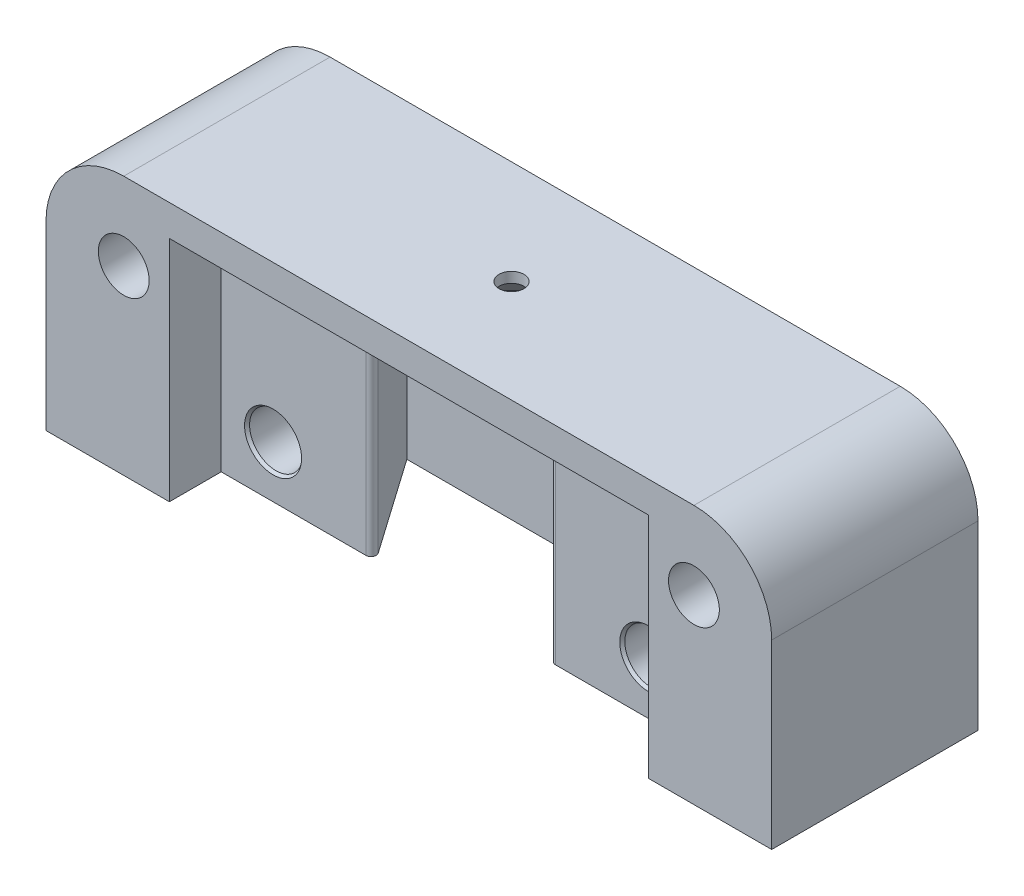
from build123d import *

# Parameters (mm, degrees)
BOSS_EXTRUDE1_DEPTH                             = 25
SKETCH2_R                                       = 2.45
CUT_EXTRUDE1_DEPTH                              = 25
FILLET1_R                                       = 7.5
SKETCH3_W                                       = 55
SKETCH3_H                                       = 19.9
BOSS_EXTRUDE2_DEPTH                             = 3
CSK_FOR_M2_FLAT_HEAD_MACHINE_SCREW1_D           = 2.4
CSK_FOR_M2_FLAT_HEAD_MACHINE_SCREW1_DEPTH       = 10
CSK_FOR_M2_FLAT_HEAD_MACHINE_SCREW1_CSINK_D     = 6.4
CSK_FOR_M2_FLAT_HEAD_MACHINE_SCREW1_CSINK_ANGLE = 90
CSK_FOR_M2_FLAT_HEAD_MACHINE_SCREW1_TIP         = 0.721032743
FILLET2_R                                       = 0.5
CSK_FOR_M5_FLAT_HEAD_MACHINE_SCREW1_D           = 5.1
CSK_FOR_M5_FLAT_HEAD_MACHINE_SCREW1_DEPTH       = 6
CSK_FOR_M5_FLAT_HEAD_MACHINE_SCREW1_CSINK_D     = 5.5
CSK_FOR_M5_FLAT_HEAD_MACHINE_SCREW1_CSINK_ANGLE = 70


with BuildPart() as part:
    # Sketch1 → Boss-Extrude1 (new body)
    with BuildSketch(Plane(origin=(0, 0, 0), x_dir=(1, 0, 0), z_dir=(0, 1, 0))):
        Polygon((-35, 10), (-35, -9.9), (-23.097924618, -9.9), (-23.097924618, -5), (-23.097924618, -4.9), (-22.997924618, -4.9), (-8.190022831, -4.9), (-15.192098213, 5.1), (15.192098213, 5.1), (8.190022831, -4.9), (22.997924618, -4.9), (23.097924618, -4.9), (23.097924618, -5), (23.097924618, -9.9), (35, -9.9), (35, 10), align=None)
    extrude(amount=BOSS_EXTRUDE1_DEPTH)

    # Sketch2 → Cut-Extrude1 (cut)
    with BuildSketch(Plane(origin=(0, 0, -10), x_dir=(-1, 0, 0), z_dir=(0, 0, -1))):
        with Locations((-27.5, 17.5)):
            Circle(SKETCH2_R)
        with Locations((27.5, 17.5)):
            Circle(SKETCH2_R)
    extrude(amount=-CUT_EXTRUDE1_DEPTH, mode=Mode.SUBTRACT)

    # Fillet1
    fillet1_edges = [part.edges().sort_by_distance(p)[0] for p in [
        (-35, 25, -0.05),
        (35, 25, -0.05),
    ]]
    fillet(fillet1_edges, radius=FILLET1_R)

    # Sketch3 → Boss-Extrude2 (add)
    with BuildSketch(Plane(origin=(0, 25, 0), x_dir=(1, 0, 0), z_dir=(0, 1, 0))):
        with Locations((0, 0.05)):
            Rectangle(SKETCH3_W, SKETCH3_H)
    extrude(amount=-BOSS_EXTRUDE2_DEPTH)

    # CSK for M2 Flat Head Machine Screw1
    with Locations(Plane(origin=(0, 22, 0), x_dir=(-1, 0, 0), z_dir=(0, -1, 0))):
        with Locations((0, 0)):
            CounterSinkHole(CSK_FOR_M2_FLAT_HEAD_MACHINE_SCREW1_D / 2, CSK_FOR_M2_FLAT_HEAD_MACHINE_SCREW1_CSINK_D / 2, depth=CSK_FOR_M2_FLAT_HEAD_MACHINE_SCREW1_DEPTH, counter_sink_angle=CSK_FOR_M2_FLAT_HEAD_MACHINE_SCREW1_CSINK_ANGLE)
            with Locations((0, 0, -(CSK_FOR_M2_FLAT_HEAD_MACHINE_SCREW1_DEPTH + CSK_FOR_M2_FLAT_HEAD_MACHINE_SCREW1_TIP / 2))):  # 118° drill point
                Cone(0, CSK_FOR_M2_FLAT_HEAD_MACHINE_SCREW1_D / 2, CSK_FOR_M2_FLAT_HEAD_MACHINE_SCREW1_TIP, mode=Mode.SUBTRACT)

    # Fillet2
    fillet2_edges = [part.edges().sort_by_distance(p)[0] for p in [
        (8.190022831, 11, 4.9),
        (-8.190022831, 11, 4.9),
    ]]
    fillet(fillet2_edges, radius=FILLET2_R)

    # Sketch10 → Cut-Revolve1 (revolve, cut)
    with BuildSketch(Plane(origin=(0, 17.5, 0), x_dir=(1, 0, 0), z_dir=(0, 1, 0))):
        Polygon((-27.5, 6.052481049), (-27.5, 10.005610284), (-33.6, 10.005610284), (-33.6, 5.605610284), (-32.25, 5.213190854), (-32.25, 0.052481049), (-31.453797848, 0.052481049), (-31.453797848, 6.052481049), (-30.701898924, 6.052481049), (-31.453797848, 6.784043238), (-31.453797848, 9.993311616), (-29.95, 9.993311616), (-29.95, 6.052481049), (-29.95, 0.052481049), (-27.5, 0.052481049), align=None)
    revolve(axis=Axis((-27.5, 17.5, 990.182204964), (0, 0, -1)), mode=Mode.SUBTRACT)

    # Sketch10<3> → Cut-Revolve2 (revolve, cut)
    with BuildSketch(Plane(origin=(0, 17.5, 0), x_dir=(1, 0, 0), z_dir=(0, 1, 0))):
        Polygon((31.453797848, 9.993311616), (31.453797848, 6.784043238), (30.701898924, 6.052481049), (31.453797848, 6.052481049), (31.453797848, 0.052481049), (32.25, 0.052481049), (32.25, 5.213190854), (33.6, 5.605610284), (33.6, 10.005610284), (27.5, 10.005610284), (27.5, 6.052481049), (27.5, 0.052481049), (29.95, 0.052481049), (29.95, 6.052481049), (29.95, 9.993311616), align=None)
    revolve(axis=Axis((27.5, 17.5, 990.028974512), (0, 0, -1)), mode=Mode.SUBTRACT)

    # CSK for M5 Flat Head Machine Screw1
    with Locations(Plane.XY.offset(4.9)):
        with Locations((-18.097924618, 5), (18.097924618, 5)):
            CounterSinkHole(CSK_FOR_M5_FLAT_HEAD_MACHINE_SCREW1_D / 2, CSK_FOR_M5_FLAT_HEAD_MACHINE_SCREW1_CSINK_D / 2, depth=CSK_FOR_M5_FLAT_HEAD_MACHINE_SCREW1_DEPTH, counter_sink_angle=CSK_FOR_M5_FLAT_HEAD_MACHINE_SCREW1_CSINK_ANGLE)


solid = part.part
